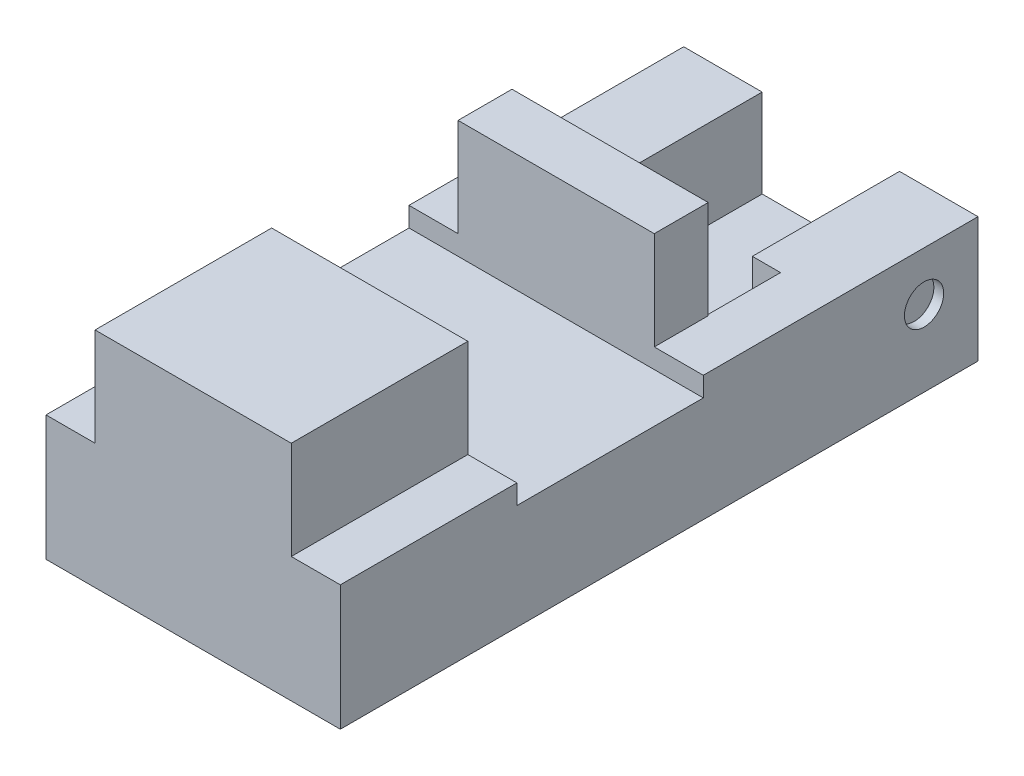
from build123d import *

# Parameters (mm, degrees)
BOSS_EXTRUDE1_DEPTH = 1.8
SKETCH2_W           = 6
SKETCH2_H           = 13
BOSS_EXTRUDE2_DEPTH = 0.75
SKETCH7_W           = 6
SKETCH7_H           = 3.8
CUT_EXTRUDE2_DEPTH  = 0.4
SKETCH9_R           = 0.4
CUT_EXTRUDE4_DEPTH  = 0.2
SKETCH10_W          = 4
SKETCH10_H          = 1.1
SKETCH10_H_2        = 3.6
BOSS_EXTRUDE3_DEPTH = 2


with BuildPart() as part:
    # Sketch1 → Boss-Extrude1 (new body)
    with BuildSketch(Plane(origin=(0, 0, 0), x_dir=(1, 0, 0), z_dir=(0, 1, 0))):
        Polygon((-1.4, 3), (-1.4, 0), (-1.975, 0), (-1.975, -1.5), (1.975, -1.5), (1.975, 0), (1.4, 0), (1.4, 3), (3, 3), (3, -10), (-3, -10), (-3, 3), align=None)
    extrude(amount=BOSS_EXTRUDE1_DEPTH)

    # Sketch2 → Boss-Extrude2 (add)
    with BuildSketch(Plane.XZ):
        with Locations((0, 3.5)):
            Rectangle(SKETCH2_W, SKETCH2_H)
    extrude(amount=BOSS_EXTRUDE2_DEPTH)

    # Sketch7 → Cut-Extrude2 (cut)
    with BuildSketch(Plane(origin=(0, 1.8, 0), x_dir=(1, 0, 0), z_dir=(0, 1, 0))):
        with Locations((0, -4.5)):
            Rectangle(SKETCH7_W, SKETCH7_H)
    extrude(amount=-CUT_EXTRUDE2_DEPTH, mode=Mode.SUBTRACT)

    # Sketch9 → Cut-Extrude4 (cut)
    with BuildSketch(Plane(origin=(3, 0, 0), x_dir=(0, 0, -1), z_dir=(1, 0, 0))):
        with Locations((1.9, 0.8)):
            Circle(SKETCH9_R)
    cut_extrude4 = extrude(amount=-CUT_EXTRUDE4_DEPTH, mode=Mode.SUBTRACT)

    # Mirror1: Cut-Extrude4 across plane
    add(cut_extrude4.mirror(Plane(origin=(0, 0, 0), x_dir=(0, 0, 1), z_dir=(1, 0, 0))), mode=Mode.SUBTRACT)

    # Sketch10 → Boss-Extrude3 (add)
    with BuildSketch(Plane(origin=(0, 1.8, 0), x_dir=(1, 0, 0), z_dir=(0, 1, 0))):
        with Locations((0, -2.05)):
            Rectangle(SKETCH10_W, SKETCH10_H)
        with Locations((0, -8.2)):
            Rectangle(SKETCH10_W, SKETCH10_H_2)
    extrude(amount=BOSS_EXTRUDE3_DEPTH)


solid = part.part
